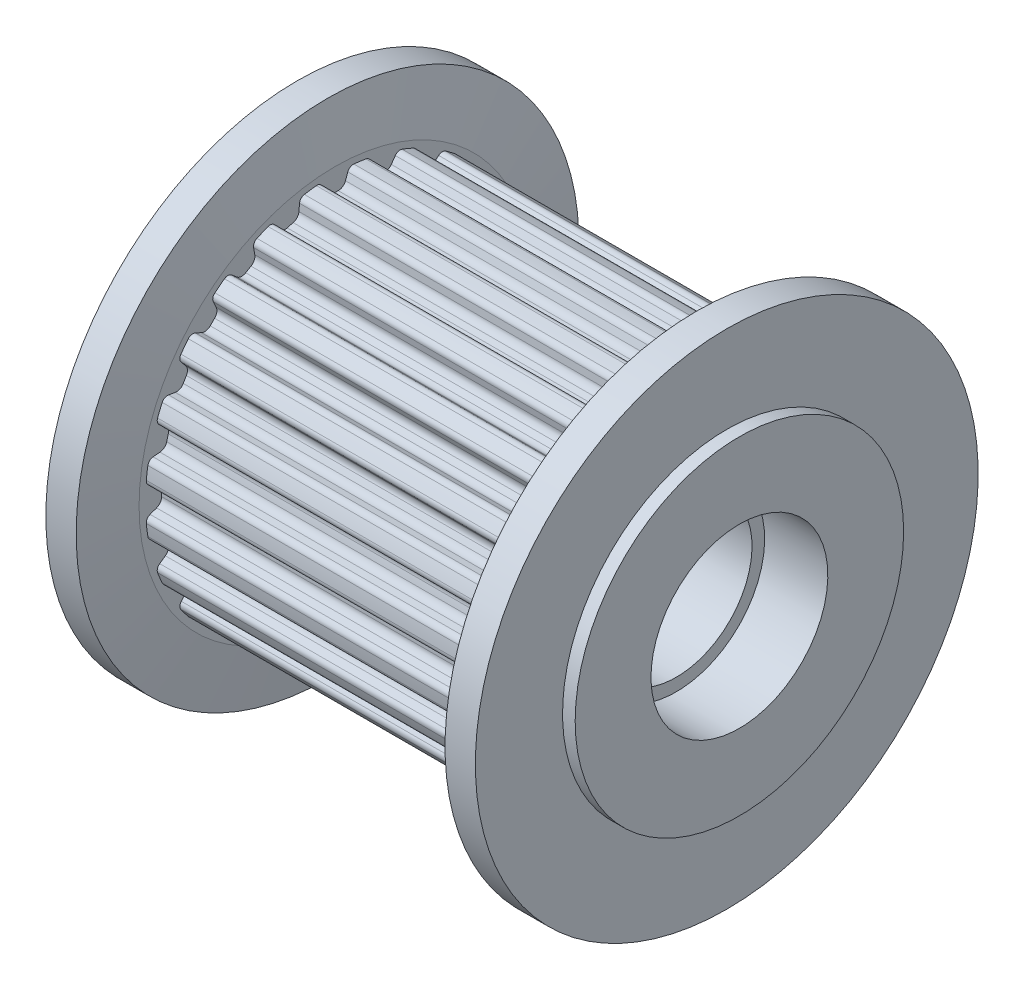
from build123d import *

# Parameters (mm, degrees)
CUT_EXTRUDE_1_DEPTH              = 20.204171422
FILLET_1_R                       = 0.3
FILLET_2_R                       = 0.23
PATTERN_CIRCULAR_1_COUNT         = 24
FILLET_1_OF_PATTERN_CIRCULAR_1_R = 0.3
FILLET_2_OF_PATTERN_CIRCULAR_1_R = 0.23


with BuildPart() as part:
    # 草图1 → 旋转1 (revolve)
    with BuildSketch(Plane.XY, mode=Mode.PRIVATE) as revolve_1_sk:
        Polygon((-9, 0), (-9, 6.5), (-7, 6.5), (-7, 7.51), (7, 7.51), (7, 6.5), (9, 6.5), (9, 0), align=None)
    revolve(revolve_1_sk.sketch.rotate(Axis((9, 0, 0), (-1, 0, 0)), 90), axis=Axis((9, 0, 0), (-1, 0, 0)))

    # 草图3 → 切除-拉伸1 (cut, through all)
    with BuildSketch(Plane.ZY.offset(7)):
        with BuildLine():
            Line((-0.563217845, 7.488850757), (-0.335, 6.861827381))
            ThreePointArc((-0.335, 6.861827381), (0, 6.87), (0.335, 6.861827381))
            Line((0.335, 6.861827381), (0.563217845, 7.488850757))
            ThreePointArc((0.563217845, 7.488850757), (0, 7.51), (-0.563217845, 7.488850757))
        make_face()
    cut_extrude_1 = extrude(amount=-CUT_EXTRUDE_1_DEPTH, mode=Mode.SUBTRACT)

    # 圆角1
    fillet_1_edges = [part.edges().sort_by_distance(p)[0] for p in [
        (0, 6.861827381, 0.335),
        (0, 6.861827381, -0.335),
    ]]
    fillet(fillet_1_edges, radius=FILLET_1_R)

    # 圆角2
    fillet_2_edges = [part.edges().sort_by_distance(p)[0] for p in [
        (0, 7.488850757, -0.563217845),
        (0, 7.488850757, 0.563217845),
    ]]
    fillet(fillet_2_edges, radius=FILLET_2_R)

    # 阵列(圆周)1: 切除-拉伸1 ×24 about axis
    pattern_circular_1_axis = Axis((0, 0, 0), (1, 0, 0))
    for i in range(1, PATTERN_CIRCULAR_1_COUNT):
        add(cut_extrude_1.rotate(pattern_circular_1_axis, i * 360 / PATTERN_CIRCULAR_1_COUNT), mode=Mode.SUBTRACT)

    # 圆角1 of 阵列(圆周)1
    fillet_1_of_pattern_circular_1_edges = [part.edges().sort_by_distance(p)[0] for p in [
        (0, 6.541311902, 2.099556762),
        (0, 6.714720662, 1.452386458),
        (0, 5.775016828, 3.721032201),
        (0, 6.110016828, 3.14079518),
        (0, 4.6151639, 5.088925444),
        (0, 5.088925444, 4.6151639),
        (0, 3.14079518, 6.110016828),
        (0, 3.721032201, 5.775016828),
        (0, 1.452386458, 6.714720662),
        (0, 2.099556762, 6.541311902),
        (0, -0.335, 6.861827381),
        (0, 0.335, 6.861827381),
        (0, -2.099556762, 6.541311902),
        (0, -1.452386458, 6.714720662),
        (0, -3.721032201, 5.775016828),
        (0, -3.14079518, 6.110016828),
        (0, -5.088925444, 4.6151639),
        (0, -4.6151639, 5.088925444),
        (0, -6.110016828, 3.14079518),
        (0, -5.775016828, 3.721032201),
        (0, -6.714720662, 1.452386458),
        (0, -6.541311902, 2.099556762),
        (0, -6.861827381, -0.335),
        (0, -6.861827381, 0.335),
        (0, -6.541311902, -2.099556762),
        (0, -6.714720662, -1.452386458),
        (0, -5.775016828, -3.721032201),
        (0, -6.110016828, -3.14079518),
        (0, -4.6151639, -5.088925444),
        (0, -5.088925444, -4.6151639),
        (0, -3.14079518, -6.110016828),
        (0, -3.721032201, -5.775016828),
        (0, -1.452386458, -6.714720662),
        (0, -2.099556762, -6.541311902),
        (0, 0.335, -6.861827381),
        (0, -0.335, -6.861827381),
        (0, 2.099556762, -6.541311902),
        (0, 1.452386458, -6.714720662),
        (0, 3.721032201, -5.775016828),
        (0, 3.14079518, -6.110016828),
        (0, 5.088925444, -4.6151639),
        (0, 4.6151639, -5.088925444),
        (0, 6.110016828, -3.14079518),
        (0, 5.775016828, -3.721032201),
        (0, 6.714720662, -1.452386458),
        (0, 6.541311902, -2.099556762),
    ]]
    fillet(fillet_1_of_pattern_circular_1_edges, radius=FILLET_1_OF_PATTERN_CIRCULAR_1_R)

    # 圆角2 of 阵列(圆周)1
    fillet_2_of_pattern_circular_1_edges = [part.edges().sort_by_distance(p)[0] for p in [
        (0, 7.37944586, 1.394230539),
        (0, 7.08790285, 2.482283864),
        (0, 6.767143923, 3.256664417),
        (0, 6.203926078, 4.23218634),
        (0, 5.693672311, 4.897161996),
        (0, 4.897161996, 5.693672311),
        (0, 4.23218634, 6.203926078),
        (0, 3.256664417, 6.767143923),
        (0, 2.482283864, 7.08790285),
        (0, 1.394230539, 7.37944586),
        (0, 0.563217845, 7.488850757),
        (0, -0.563217845, 7.488850757),
        (0, -1.394230539, 7.37944586),
        (0, -2.482283864, 7.08790285),
        (0, -3.256664417, 6.767143923),
        (0, -4.23218634, 6.203926078),
        (0, -4.897161996, 5.693672311),
        (0, -5.693672311, 4.897161996),
        (0, -6.203926078, 4.23218634),
        (0, -6.767143923, 3.256664417),
        (0, -7.08790285, 2.482283864),
        (0, -7.37944586, 1.394230539),
        (0, -7.488850757, 0.563217845),
        (0, -7.488850757, -0.563217845),
        (0, -7.37944586, -1.394230539),
        (0, -7.08790285, -2.482283864),
        (0, -6.767143923, -3.256664417),
        (0, -6.203926078, -4.23218634),
        (0, -5.693672311, -4.897161996),
        (0, -4.897161996, -5.693672311),
        (0, -4.23218634, -6.203926078),
        (0, -3.256664417, -6.767143923),
        (0, -2.482283864, -7.08790285),
        (0, -1.394230539, -7.37944586),
        (0, -0.563217845, -7.488850757),
        (0, 0.563217845, -7.488850757),
        (0, 1.394230539, -7.37944586),
        (0, 2.482283864, -7.08790285),
        (0, 3.256664417, -6.767143923),
        (0, 4.23218634, -6.203926078),
        (0, 4.897161996, -5.693672311),
        (0, 5.693672311, -4.897161996),
        (0, 6.203926078, -4.23218634),
        (0, 6.767143923, -3.256664417),
        (0, 7.08790285, -2.482283864),
        (0, 7.37944586, -1.394230539),
    ]]
    fillet(fillet_2_of_pattern_circular_1_edges, radius=FILLET_2_OF_PATTERN_CIRCULAR_1_R)

    # 草图5 → 旋转2 (revolve)
    with BuildSketch(Plane.XY, mode=Mode.PRIVATE) as revolve_2_sk:
        Polygon((-8.5, 6.5), (-8.5, 9.95), (-7.3, 9.95), (-7, 7.76), (-7, 6.5), align=None)
        Polygon((8.5, 9.95), (7.3, 9.95), (7, 7.76), (7, 6.5), (8.5, 6.5), align=None)
    revolve(revolve_2_sk.sketch.rotate(Axis((-9, 0, 0), (1, 0, 0)), 180), axis=Axis((-9, 0, 0), (1, 0, 0)))

    # 草图6 → 切除-旋转1 (revolve, cut)
    with BuildSketch(Plane.XY):
        Polygon((-9, 3.5), (-6.5, 3.5), (-6.5, 3), (6.5, 3), (6.5, 3.5), (9, 3.5), (9, 0), (-9, 0), align=None)
    revolve(axis=Axis((9, 0, 0), (-1, 0, 0)), mode=Mode.SUBTRACT)


solid = part.part
